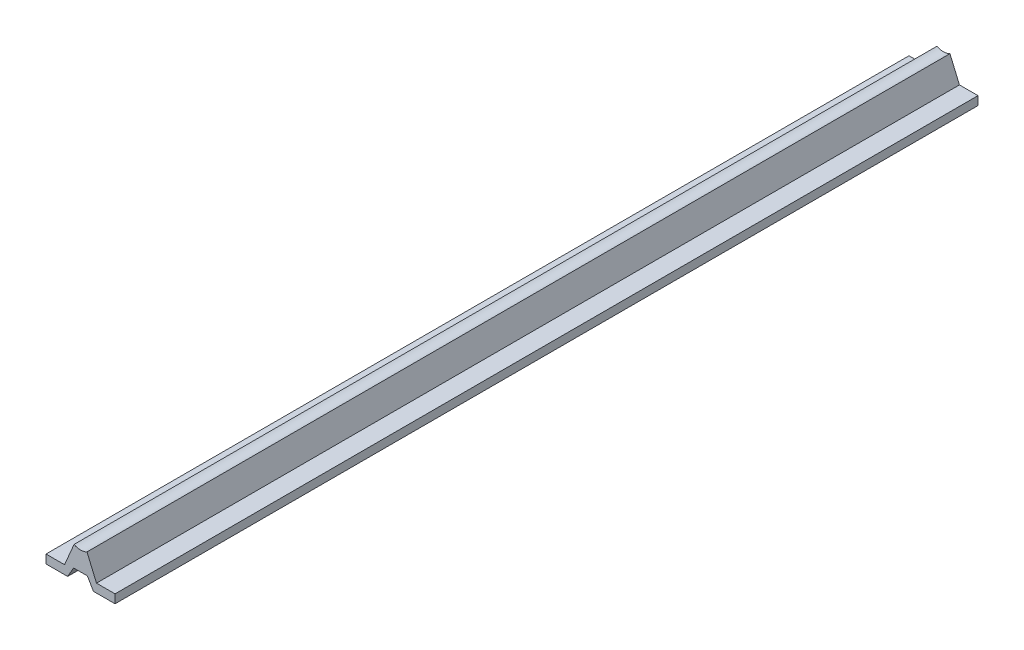
from build123d import *

# Parameters (mm, degrees)
BOSS_EXTRUDE1_DEPTH = 500


with BuildPart() as part:
    # Sketch1 → Boss-Extrude1 (new body)
    with BuildSketch(Plane.XY):
        with BuildLine():
            Line((-20, -25), (-7.464101615, -25))
            Line((-7.464101615, -25), (-4, -19))
            Line((-4, -19), (4, -19))
            Line((4, -19), (7.464101615, -25))
            Line((7.464101615, -25), (20, -25))
            Line((20, -25), (20, -20))
            Line((20, -20), (9.25, -20))
            Line((9.25, -20), (3.75, -7.066647013))
            ThreePointArc((3.75, -7.066647013), (0, -8), (-3.75, -7.066647013))
            Line((-3.75, -7.066647013), (-9.25, -20))
            Line((-9.25, -20), (-20, -20))
            Line((-20, -20), (-20, -25))
        make_face()
    extrude(amount=BOSS_EXTRUDE1_DEPTH)


solid = part.part
